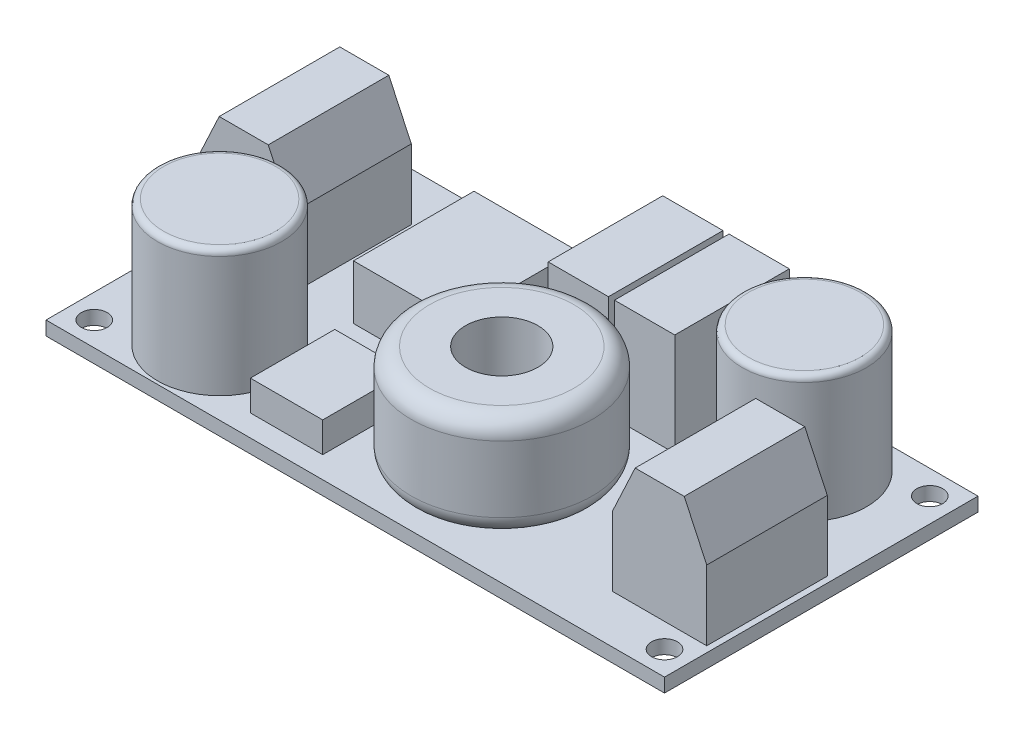
from build123d import *
from OCP.BRepFilletAPI import BRepFilletAPI_MakeChamfer

# Parameters (mm, degrees)
CROQUIS1_W                = 51.3
CROQUIS1_H                = 26
CROQUIS1_R                = 1.075
SALIENTE_EXTRUIR1_DEPTH   = 1.15
CROQUIS2_R                = 5.15
SALIENTE_EXTRUIR2_DEPTH   = 10.5
SALIENTE_EXTRUIR2_2_DEPTH = 10.5
REDONDEO1_R               = 0.5
REDONDEO2_R               = 0.5
CROQUIS3_W                = 7.8
CROQUIS3_H                = 10
SALIENTE_EXTRUIR3_DEPTH   = 9.8
SALIENTE_EXTRUIR3_2_DEPTH = 9.8
CHAFL_N1_SIZE             = 4
CHAFL_N1_SIZE2            = 1.865230633
CHAFL_N2_SIZE             = 4
CHAFL_N2_SIZE2            = 1.865230633
CROQUIS5_W                = 5
CROQUIS5_H                = 9.5
SALIENTE_EXTRUIR4_DEPTH   = 8.5
SALIENTE_EXTRUIR4_2_DEPTH = 8.5
CROQUIS6_W                = 8.5
CROQUIS6_H                = 10
SALIENTE_EXTRUIR5_DEPTH   = 4.5
CROQUIS7_W                = 6
CROQUIS7_H                = 7
SALIENTE_EXTRUIR6_DEPTH   = 2.5
CROQUIS8_W                = 4.5
CROQUIS8_H                = 8.5
REDONDEO3_R               = 1.5


with BuildPart() as part:
    # Croquis1 → Saliente-Extruir1 (new body)
    with BuildSketch(Plane(origin=(0, 0, 0), x_dir=(1, 0, 0), z_dir=(0, 1, 0))):
        Rectangle(CROQUIS1_W, CROQUIS1_H)
        with Locations(Location((23.65, 11, 0), (0, 0, 270))):
            Circle(CROQUIS1_R, mode=Mode.SUBTRACT)
        with Locations(Location((23.65, -11, 0), (0, 0, 90))):
            Circle(CROQUIS1_R, mode=Mode.SUBTRACT)
        with Locations(Location((-23.65, -11, 0), (0, 0, 270))):
            Circle(CROQUIS1_R, mode=Mode.SUBTRACT)
        with Locations(Location((-23.65, 11, 0), (0, 0, 90))):
            Circle(CROQUIS1_R, mode=Mode.SUBTRACT)
    extrude(amount=SALIENTE_EXTRUIR1_DEPTH)


with BuildPart() as body_2:
    # Croquis2 → Saliente-Extruir2 (new body)
    with BuildSketch(Plane(origin=(0, 1.15, 0), x_dir=(1, 0, 0), z_dir=(0, 1, 0))):
        with Locations(Location((16.65, 7.6, 0), (0, 0, 90))):
            Circle(CROQUIS2_R)
    extrude(amount=SALIENTE_EXTRUIR2_DEPTH)

    # Redondeo2
    redondeo2_edges = [body_2.edges().sort_by_distance(p)[0] for p in [
        (16.65, 11.65, -2.45),
    ]]
    fillet(redondeo2_edges, radius=REDONDEO2_R)


with BuildPart() as body_3:
    # Croquis2 → Saliente-Extruir2 2 (new body)
    with BuildSketch(Plane(origin=(0, 1.15, 0), x_dir=(1, 0, 0), z_dir=(0, 1, 0))):
        with Locations(Location((-16.65, -7.6, 0), (0, 0, 90))):
            Circle(CROQUIS2_R)
    extrude(amount=SALIENTE_EXTRUIR2_2_DEPTH)

    # Redondeo1
    redondeo1_edges = [body_3.edges().sort_by_distance(p)[0] for p in [
        (-16.65, 11.65, 12.75),
    ]]
    fillet(redondeo1_edges, radius=REDONDEO1_R)


with BuildPart() as body_4:
    # Croquis3 → Saliente-Extruir3 (new body)
    with BuildSketch(Plane(origin=(0, 1.15, 0), x_dir=(1, 0, 0), z_dir=(0, 1, 0))):
        with Locations((21.25, -4)):
            Rectangle(CROQUIS3_W, CROQUIS3_H)
    extrude(amount=SALIENTE_EXTRUIR3_DEPTH)

    # Chaflán1: one chamfer whose edges measure the first distance from different faces: ONE call of the kernel's chamfer builder (chamfer() names one face for all edges)
    chafl_n1_edges_1 = [body_4.edges().sort_by_distance(p)[0] for p in [
        (25.15, 10.95, 4),
    ]]
    chafl_n1_side_1 = [body_4.faces().sort_by_distance(p)[0] for p in [
        (25.15, 6.05, 4),
    ]]
    chafl_n1_edges_2 = [body_4.edges().sort_by_distance(p)[0] for p in [
        (17.35, 10.95, 4),
    ]]
    chafl_n1_side_2 = [body_4.faces().sort_by_distance(p)[0] for p in [
        (17.35, 6.05, 4),
    ]]
    chafl_n1 = BRepFilletAPI_MakeChamfer(body_4.part.solid().wrapped)
    for e in chafl_n1_edges_1:
        chafl_n1.Add(CHAFL_N1_SIZE, CHAFL_N1_SIZE2, e.wrapped, chafl_n1_side_1[0].wrapped)  # the first distance lies on this face
    for e in chafl_n1_edges_2:
        chafl_n1.Add(CHAFL_N1_SIZE, CHAFL_N1_SIZE2, e.wrapped, chafl_n1_side_2[0].wrapped)  # the first distance lies on this face
    add(Compound.cast(chafl_n1.Shape()), mode=Mode.REPLACE)


with BuildPart() as body_5:
    # Croquis3 → Saliente-Extruir3 2 (new body)
    with BuildSketch(Plane(origin=(0, 1.15, 0), x_dir=(1, 0, 0), z_dir=(0, 1, 0))):
        with Locations((-21.25, 4)):
            Rectangle(CROQUIS3_W, CROQUIS3_H)
    extrude(amount=SALIENTE_EXTRUIR3_2_DEPTH)

    # Chaflán2: one chamfer whose edges measure the first distance from different faces: ONE call of the kernel's chamfer builder (chamfer() names one face for all edges)
    chafl_n2_edges_1 = [body_5.edges().sort_by_distance(p)[0] for p in [
        (-17.35, 10.95, -4),
    ]]
    chafl_n2_side_1 = [body_5.faces().sort_by_distance(p)[0] for p in [
        (-17.35, 6.05, -4),
    ]]
    chafl_n2_edges_2 = [body_5.edges().sort_by_distance(p)[0] for p in [
        (-25.15, 10.95, -4),
    ]]
    chafl_n2_side_2 = [body_5.faces().sort_by_distance(p)[0] for p in [
        (-25.15, 6.05, -4),
    ]]
    chafl_n2 = BRepFilletAPI_MakeChamfer(body_5.part.solid().wrapped)
    for e in chafl_n2_edges_1:
        chafl_n2.Add(CHAFL_N2_SIZE, CHAFL_N2_SIZE2, e.wrapped, chafl_n2_side_1[0].wrapped)  # the first distance lies on this face
    for e in chafl_n2_edges_2:
        chafl_n2.Add(CHAFL_N2_SIZE, CHAFL_N2_SIZE2, e.wrapped, chafl_n2_side_2[0].wrapped)  # the first distance lies on this face
    add(Compound.cast(chafl_n2.Shape()), mode=Mode.REPLACE)


with BuildPart() as body_6:
    # Croquis5 → Saliente-Extruir4 (new body)
    with BuildSketch(Plane(origin=(0, 1.15, 0), x_dir=(1, 0, 0), z_dir=(0, 1, 0))):
        with Locations((7.5, 8.25)):
            Rectangle(CROQUIS5_W, CROQUIS5_H)
    extrude(amount=SALIENTE_EXTRUIR4_DEPTH)


with BuildPart() as body_7:
    # Croquis5 → Saliente-Extruir4 2 (new body)
    with BuildSketch(Plane(origin=(0, 1.15, 0), x_dir=(1, 0, 0), z_dir=(0, 1, 0))):
        with Locations((2, 8.25)):
            Rectangle(CROQUIS5_W, CROQUIS5_H)
    extrude(amount=SALIENTE_EXTRUIR4_2_DEPTH)


with BuildPart() as body_8:
    # Croquis6 → Saliente-Extruir5 (new body)
    with BuildSketch(Plane(origin=(0, 1.15, 0), x_dir=(1, 0, 0), z_dir=(0, 1, 0))):
        with Locations((-8.4, 4.5)):
            Rectangle(CROQUIS6_W, CROQUIS6_H)
    extrude(amount=SALIENTE_EXTRUIR5_DEPTH)


with BuildPart() as body_9:
    # Croquis7 → Saliente-Extruir6 (new body)
    with BuildSketch(Plane(origin=(0, 1.15, 0), x_dir=(1, 0, 0), z_dir=(0, 1, 0))):
        with Locations((-7.5, -7.7)):
            Rectangle(CROQUIS7_W, CROQUIS7_H)
    extrude(amount=SALIENTE_EXTRUIR6_DEPTH)


with BuildPart() as body_10:
    # Croquis8 → Revolución1 (revolve)
    with BuildSketch(Plane(origin=(3.65, 0, 0), x_dir=(0, 0, -1), z_dir=(1, 0, 0)), mode=Mode.PRIVATE) as revoluci_n1_sk:
        with Locations((-9.75, 5.4)):
            Rectangle(CROQUIS8_W, CROQUIS8_H)
    revolve(revoluci_n1_sk.sketch.rotate(Axis((3.65, 1.15, 4.5), (0, 1, 0)), 180), axis=Axis((3.65, 1.15, 4.5), (0, 1, 0)))

    # Redondeo3
    redondeo3_edges = [body_10.edges().sort_by_distance(p)[0] for p in [
        (3.65, 9.65, 12),
        (3.65, 1.15, 12),
    ]]
    fillet(redondeo3_edges, radius=REDONDEO3_R)


solid = Compound([part.part, body_2.part, body_3.part, body_4.part, body_5.part, body_6.part, body_7.part, body_8.part, body_9.part, body_10.part])
